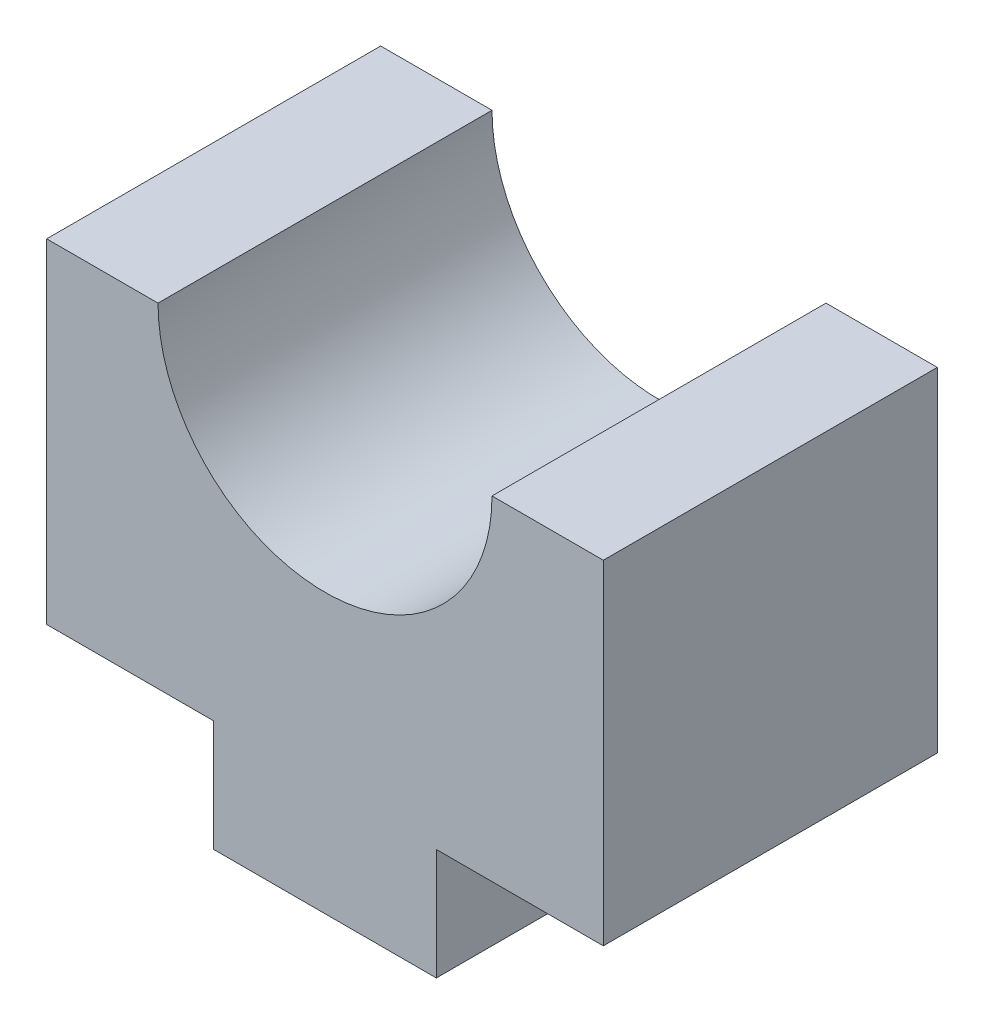
from build123d import *

# Parameters (mm, degrees)
SALIENTE_EXTRUIR1_DEPTH = 15


with BuildPart() as part:
    # Croquis1 → Saliente-Extruir1 (new body)
    with BuildSketch(Plane.XY):
        with BuildLine():
            Line((7.5, 0), (12.5, 0))
            Line((12.5, 0), (12.5, -15))
            Line((12.5, -15), (5, -15))
            Line((5, -15), (5, -20))
            Line((5, -20), (-5, -20))
            Line((-5, -20), (-5, -15))
            Line((-5, -15), (-12.5, -15))
            Line((-12.5, -15), (-12.5, 0))
            Line((-12.5, 0), (-7.5, 0))
            ThreePointArc((-7.5, 0), (0, -7.5), (7.5, 0))
        make_face()
    extrude(amount=-SALIENTE_EXTRUIR1_DEPTH)


solid = part.part
